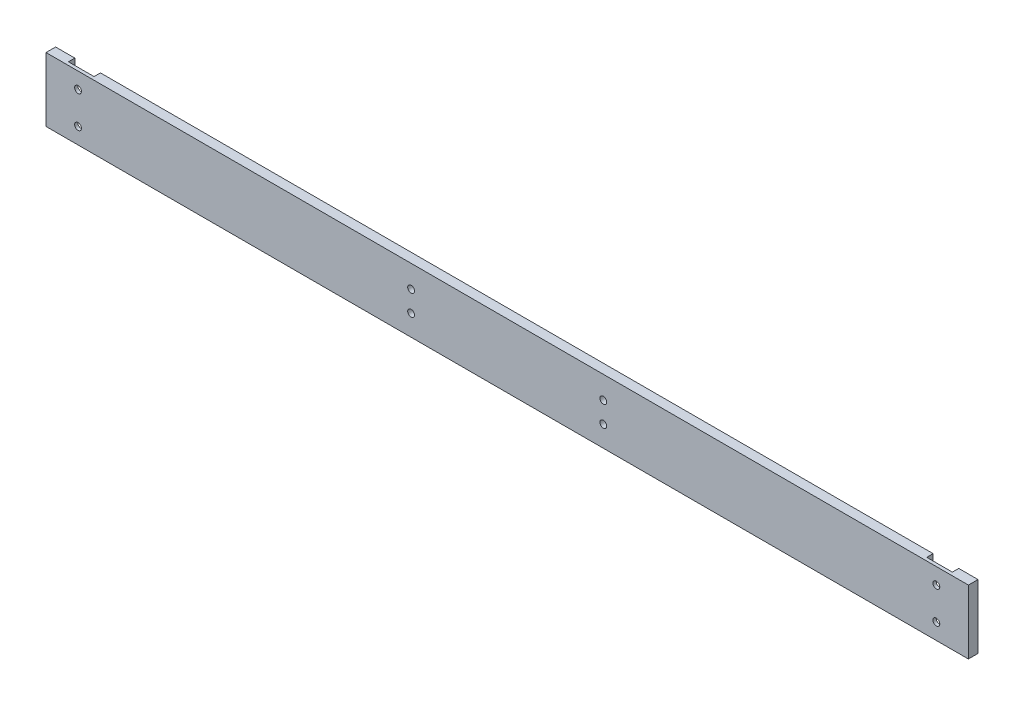
from build123d import *

# Parameters (mm, degrees)
SKETCH1_W               = 914.4
SKETCH1_H               = 9.525
BOSS_EXTRUDE1_DEPTH     = 63.5
SKETCH2_W               = 25.4
SKETCH2_H               = 63.5
CUT_EXTRUDE1_DEPTH      = 6.35
F_1_4_CLEARANCE_HOLE1_D = 6.7564
F_1_4_CLEARANCE_HOLE2_D = 6.7564
LPATTERN1_COUNT         = 3
LPATTERN1_PITCH         = 15.875
MIRROR1_COPY_1_D        = 6.7564


with BuildPart() as part:
    # Sketch1 → Boss-Extrude1 (new body)
    with BuildSketch(Plane(origin=(0, 0, 0), x_dir=(1, 0, 0), z_dir=(0, 1, 0))):
        with Locations((0, 4.7625)):
            Rectangle(SKETCH1_W, SKETCH1_H)
    extrude(amount=BOSS_EXTRUDE1_DEPTH)

    # Sketch2 → Cut-Extrude1 (cut)
    with BuildSketch(Plane(origin=(0, 0, -9.525), x_dir=(-1, 0, 0), z_dir=(0, 0, -1))):
        with Locations((-425.45, 31.75)):
            Rectangle(SKETCH2_W, SKETCH2_H)
    cut_extrude1 = extrude(amount=-CUT_EXTRUDE1_DEPTH, mode=Mode.SUBTRACT)

    # 1/4 Clearance Hole1 (through all)
    with Locations(Plane.XY):
        with Locations((425.45, 47.625)):
            f_1_4_clearance_hole1 = Hole(F_1_4_CLEARANCE_HOLE1_D / 2)

    # 1/4 Clearance Hole2 (through all)
    with Locations(Plane.XY):
        with Locations((-95.25, 41.275), (-95.25, 20.6375), (95.25, 41.275), (95.25, 20.6375)):
            Hole(F_1_4_CLEARANCE_HOLE2_D / 2)

    # LPattern1: 1/4 Clearance Hole1 ×3, 1 skipped
    with Locations(*[(0, -i * LPATTERN1_PITCH, 0) for i in range(1, LPATTERN1_COUNT) if i not in (1,)]):
        add(f_1_4_clearance_hole1, mode=Mode.SUBTRACT)

    # Mirror1: Cut-Extrude1, 1/4 Clearance Hole1 across plane
    add(cut_extrude1.mirror(Plane(origin=(0, 0, 0), x_dir=(0, 0, 1), z_dir=(1, 0, 0))), mode=Mode.SUBTRACT)
    add(f_1_4_clearance_hole1.mirror(Plane(origin=(0, 0, 0), x_dir=(0, 0, 1), z_dir=(1, 0, 0))), mode=Mode.SUBTRACT)

    # Mirror1 copy 1 (through all)
    with Locations(Plane(origin=(0, -31.75, 0), x_dir=(-1, 0, 0), z_dir=(0, 0, 1))):
        with Locations((425.45, -47.625)):
            Hole(MIRROR1_COPY_1_D / 2)


solid = part.part
